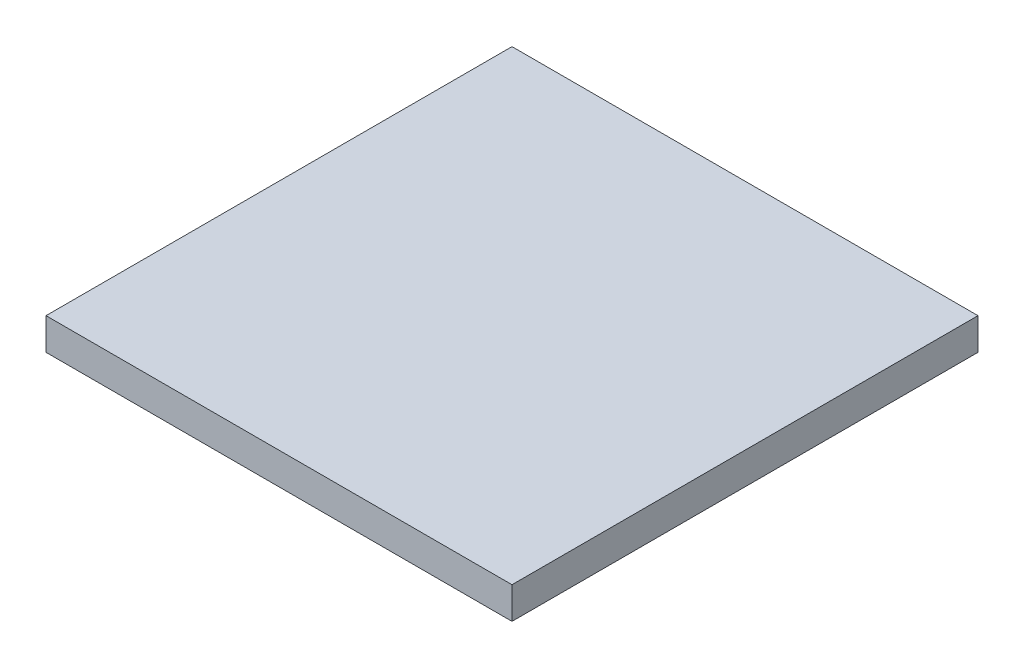
from build123d import *

# Parameters (mm, degrees)
ESQUISSE1_W        = 44
ESQUISSE1_H        = 44
BOSS_EXTRU_1_DEPTH = 3


with BuildPart() as part:
    # Esquisse1 → Boss.-Extru.1 (new body)
    with BuildSketch(Plane(origin=(0, 0, 0), x_dir=(1, 0, 0), z_dir=(0, 1, 0))):
        Rectangle(ESQUISSE1_W, ESQUISSE1_H)
    extrude(amount=BOSS_EXTRU_1_DEPTH)


solid = part.part
